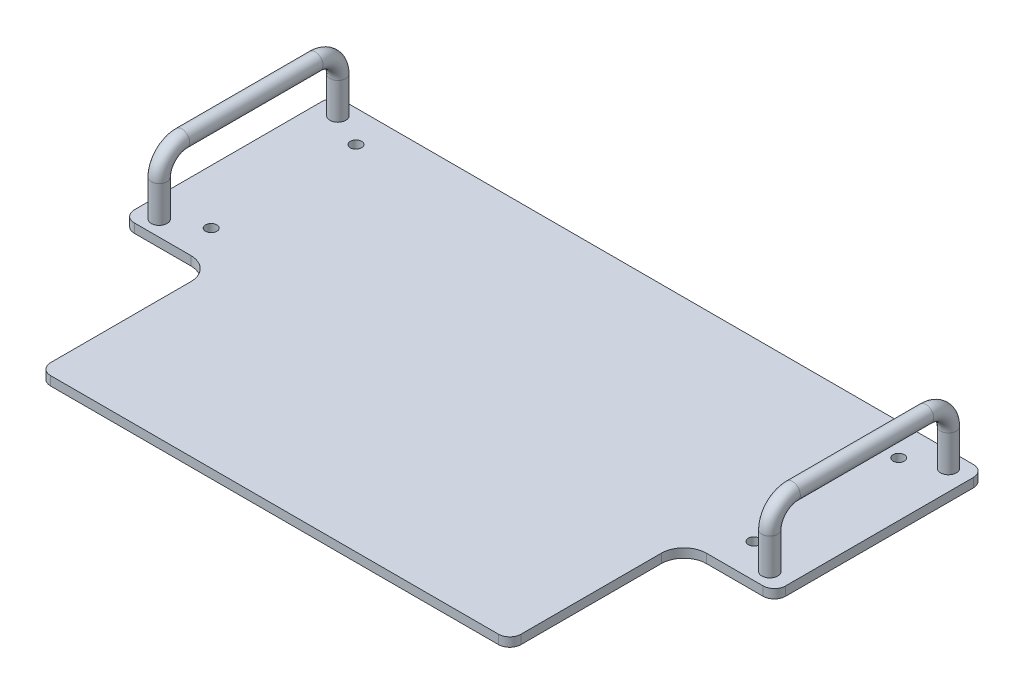
from build123d import *

# Parameters (mm, degrees)
BOSS_EXTRU_1_DEPTH      = 4
BALAYAGE13_PROFILE_R    = 3.5
BALAYAGE14_PROFILE_R    = 3.5
ESQUISSE34_R            = 2.5
ENL_V_MAT_EXTRU_1_DEPTH = 10


with BuildPart() as part:
    # Esquisse1 → Boss.-Extru.1 (new body)
    with BuildSketch(Plane(origin=(0, 0, 0), x_dir=(1, 0, 0), z_dir=(0, 1, 0))):
        with BuildLine():
            Line((5, 0), (203, 0))
            ThreePointArc((203, 0), (206.535533906, 1.464466094), (208, 5))
            Line((208, 5), (208, 67))
            ThreePointArc((208, 67), (210.928932188, 74.071067812), (218, 77))
            Line((218, 77), (243, 77))
            ThreePointArc((243, 77), (246.535533906, 78.464466094), (248, 82))
            Line((248, 82), (248, 165))
            ThreePointArc((248, 165), (246.535533906, 168.535533906), (243, 170))
            Line((243, 170), (-35, 170))
            ThreePointArc((-35, 170), (-38.535533906, 168.535533906), (-40, 165))
            Line((-40, 165), (-40, 82))
            ThreePointArc((-40, 82), (-38.535533906, 78.464466094), (-35, 77))
            Line((-35, 77), (-10, 77))
            ThreePointArc((-10, 77), (-2.928932188, 74.071067812), (0, 67))
            Line((0, 67), (0, 5))
            ThreePointArc((0, 5), (1.464466094, 1.464466094), (5, 0))
        make_face()
    extrude(amount=BOSS_EXTRU_1_DEPTH)

    # Balayage13: sweep along a path in Esquisse12
    with BuildLine(Plane(origin=(239, 0, 0), x_dir=(0, 0, -1), z_dir=(1, 0, 0))) as balayage13_path:
        Line((84, 4), (84, 20))
        ThreePointArc((84, 20), (86.928932188, 27.071067812), (94, 30))
        Line((94, 30), (153, 30))
        ThreePointArc((153, 30), (160.071067812, 27.071067812), (163, 20))
        Line((163, 20), (163, 4))
    # Balayage13 profile (on start of the path) → Balayage13 (sweep)
    with BuildSketch(Plane(origin=(239, 4, -84), x_dir=(0, 0, 1), z_dir=(0, 1, 0))):
        Circle(BALAYAGE13_PROFILE_R)
    sweep(path=balayage13_path.line)

    # Balayage14: sweep along a path in Esquisse33
    with BuildLine(Plane.ZY.offset(31)) as balayage14_path:
        Line((-163, 4), (-163, 20))
        ThreePointArc((-163, 20), (-160.071067812, 27.071067812), (-153, 30))
        Line((-153, 30), (-94, 30))
        ThreePointArc((-94, 30), (-86.928932188, 27.071067812), (-84, 20))
        Line((-84, 20), (-84, 4))
    # Balayage14 profile (on start of the path) → Balayage14 (sweep)
    with BuildSketch(Plane(origin=(-31, 4, -163), x_dir=(0, 0, 1), z_dir=(0, 1, 0))):
        Circle(BALAYAGE14_PROFILE_R)
    sweep(path=balayage14_path.line)

    # Esquisse34 → Enlèv. mat.-Extru.1 (cut)
    with BuildSketch(Plane(origin=(0, 4, 0), x_dir=(1, 0, 0), z_dir=(0, 1, 0))):
        with Locations(Location((-16, 156, 0), (0, 0, 270))):
            Circle(ESQUISSE34_R)
        with Locations(Location((224, 156, 0), (0, 0, 270))):
            Circle(ESQUISSE34_R)
        with Locations(Location((-16, 92, 0), (0, 0, 270))):
            Circle(ESQUISSE34_R)
        with Locations(Location((224, 92, 0), (0, 0, 270))):
            Circle(ESQUISSE34_R)
    extrude(amount=-ENL_V_MAT_EXTRU_1_DEPTH, mode=Mode.SUBTRACT)


solid = part.part
